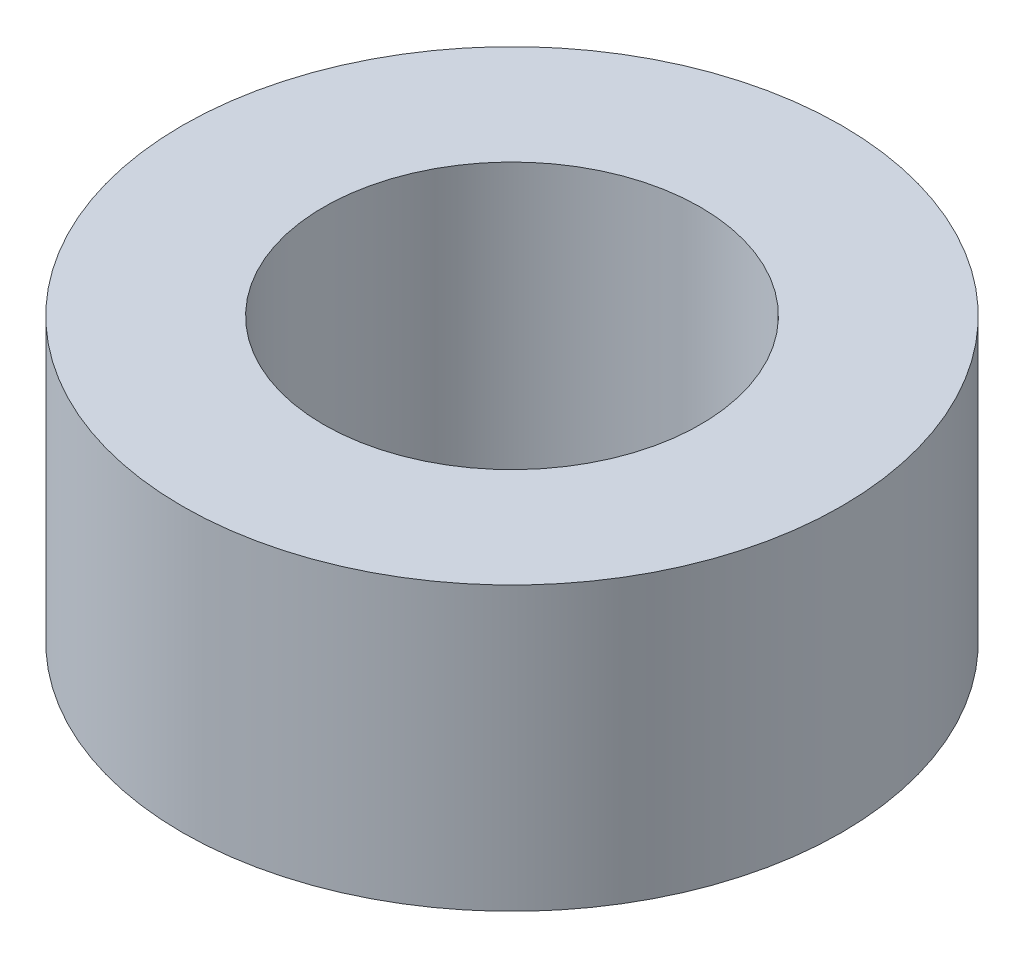
from build123d import *

# Parameters (mm, degrees)
SKETCH_1_R      = 3.5
SKETCH_1_R_2    = 2
EXTRUDE_1_DEPTH = 3


with BuildPart() as part:
    # 草图1 → 凸台-拉伸1 (new body)
    with BuildSketch(Plane(origin=(0, 0, 0), x_dir=(1, 0, 0), z_dir=(0, 1, 0))):
        with Locations(Location((0, 0, 0), (0, 0, 270))):
            Circle(SKETCH_1_R)
        with Locations(Location((0, 0, 0), (0, 0, 270))):
            Circle(SKETCH_1_R_2, mode=Mode.SUBTRACT)
    extrude(amount=EXTRUDE_1_DEPTH)


solid = part.part
